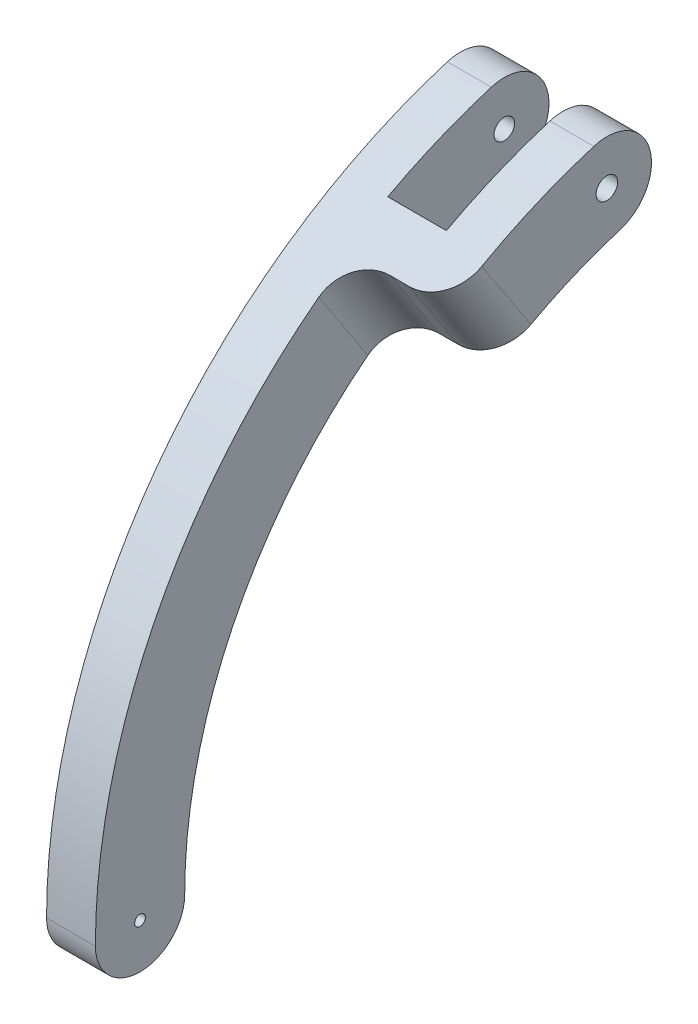
from build123d import *

# Parameters (mm, degrees)
ESQUISSE1_R                  = 0.550000000000003
ESQUISSE1_R_2                = 1.050000000000001
BOSS_EXTRU_1_DEPTH           = 5
BOSS_EXTRU_2_DEPTH           = 10
ENL_V_MAT_EXTRU_1_DEPTH      = 61.96067460568836
ENL_V_MAT_EXTRU_1_DEPTH_BACK = 61.96067460568836
CONG_1_R                     = 4
ESQUISSE4_R                  = 1.0999999999999948
ENL_V_MAT_EXTRU_2_DEPTH      = 81.96368978508603


with BuildPart() as part:
    # Esquisse1 → Boss.-Extru.1 (new body)
    with BuildSketch(Plane(origin=(0, 0, 0), x_dir=(0, 0, -1), z_dir=(1, 0, 0))):
        with BuildLine():
            ThreePointArc((-48.767999999999994, 0), (-39.18749628154784, 29.028571428571436), (-14.210176870748295, 46.65178128755695))
            ThreePointArc((-14.210176870748295, 46.65178128755695), (-11.168776456672475, 52.35758986489808), (-16.874585034013602, 55.39899027897389))
            ThreePointArc((-16.874585034013602, 55.39899027897389), (-46.53515183433805, 34.47142857142858), (-57.91199999999999, 0))
            ThreePointArc((-57.91199999999999, 0), (-53.339999999999996, -4.571999999999996), (-48.767999999999994, 0))
        make_face()
        with Locations((-53.339999999999996, 0)):
            Circle(ESQUISSE1_R, mode=Mode.SUBTRACT)
        with Locations((-15.542380952380952, 51.02538578326543)):
            Circle(ESQUISSE1_R_2, mode=Mode.SUBTRACT)
    extrude(amount=BOSS_EXTRU_1_DEPTH)

    # Esquisse2 → Boss.-Extru.2 (add)
    with BuildSketch(Plane(origin=(5, 0, 0), x_dir=(0, 0, -1), z_dir=(1, 0, 0))):
        with BuildLine():
            Line((-31.772627007894677, 48.41797101301542), (-26.755896427700776, 40.77302822148666))
            ThreePointArc((-26.755896427700776, 40.77302822148666), (-20.692866519079303, 44.16019813388031), (-14.210176870748292, 46.65178128755695))
            ThreePointArc((-14.210176870748292, 46.65178128755695), (-11.168776456672475, 52.35758986489808), (-16.874585034013602, 55.3989902789739))
            ThreePointArc((-16.874585034013602, 55.3989902789739), (-24.57277899140668, 52.44023528398287), (-31.772627007894677, 48.41797101301542))
        make_face()
    extrude(amount=BOSS_EXTRU_2_DEPTH)

    # Esquisse3 → Enlèv. mat.-Extru.1 (cut, two sides: drawn at the far end of the back side and taken through both)
    with BuildSketch(Plane(origin=(-2.205e-14, 48.41797101301542, 31.77262700789469), x_dir=(-1, 0, -6.9e-16), z_dir=(0, 0.836061110184684, 0.5486363276677492)).offset(-ENL_V_MAT_EXTRU_1_DEPTH_BACK)):
        Polygon((-4.500000000000018, -21.069257970907522), (-10.500000000000023, -21.069257970907522), (-10.500000000000023, -5.000000000000025), (-4.500000000000011, -5.0000000000000195), align=None)
    extrude(amount=ENL_V_MAT_EXTRU_1_DEPTH + ENL_V_MAT_EXTRU_1_DEPTH_BACK, mode=Mode.SUBTRACT)

    # Congé1
    cong_1_edges = [part.edges().sort_by_distance(p)[0] for p in [
        (5, 44.595499617251036, 29.264261717797726),
        (15, 44.595499617251036, 29.264261717797726),
    ]]
    fillet(cong_1_edges, radius=CONG_1_R)

    # Esquisse4 → Enlèv. mat.-Extru.2 (cut, through all)
    with BuildSketch(Plane.ZY.offset(-10.500000000000023)):
        with Locations((15.542380952380947, 51.02538578326543)):
            Circle(ESQUISSE4_R)
    extrude(amount=-ENL_V_MAT_EXTRU_2_DEPTH, mode=Mode.SUBTRACT)


solid = part.part
